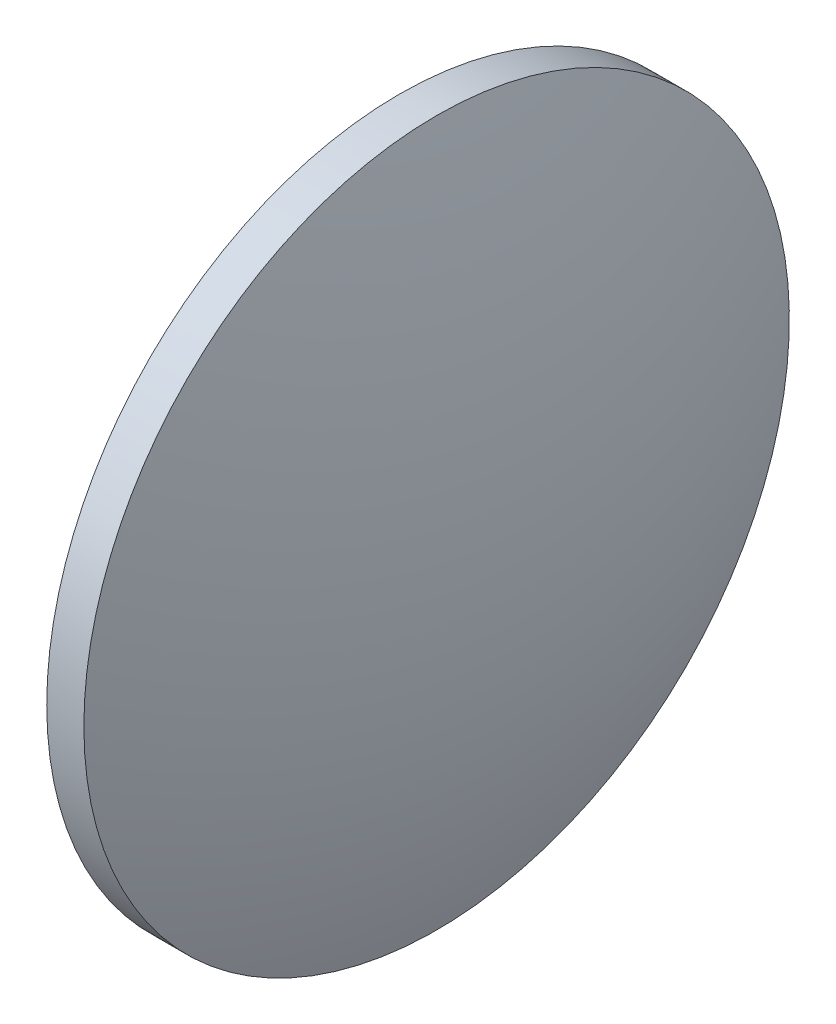
from build123d import *


with BuildPart() as part:
    # Sketch1 → Revolve1 (revolve)
    with BuildSketch(Plane.XY):
        with BuildLine():
            Line((0, 19), (2, 19))
            ThreePointArc((2, 19), (4.51535101, 9.647616508), (5.362442143, 0))
            Line((5.362442143, 0), (-3.488316481, 0))
            ThreePointArc((-3.488316481, 0), (-2.609009799, 9.658782944), (0, 19))
        make_face()
    revolve(axis=Axis((-3.488316481, 0, 0), (1, 0, 0)))


solid = part.part
